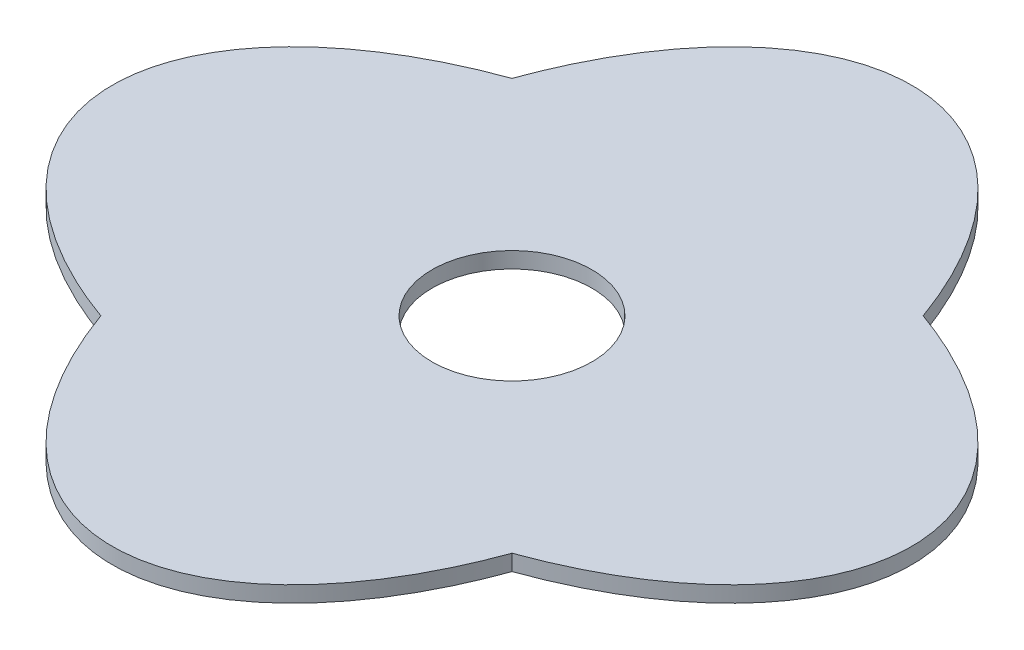
from build123d import *

# Parameters (mm, degrees)
SZKIC1_RX                   = 50
SZKIC1_RY                   = 30
DODANIE_WYCI_GNI_CIE1_DEPTH = 2
WYTNIJ_WYCI_GNI_CIE1_REACH  = 72.739
SZKIC1_4_R                  = 10


with BuildPart() as part:
    # Szkic1 → Dodanie-wyciągnięcie1 (new body)
    with BuildSketch(Plane(origin=(0, 0, 0), x_dir=(1, 0, 0), z_dir=(0, 1, 0))):
        with Locations(Location((0, 0), (0, 0, -90))):
            Ellipse(SZKIC1_RX, SZKIC1_RY)
        with Locations((0, 0)):
            Ellipse(SZKIC1_RX, SZKIC1_RY)
    extrude(amount=DODANIE_WYCI_GNI_CIE1_DEPTH)

    # Szkic1<4> → Wytnij-wyciągnięcie1 (cut, up to next)
    with BuildSketch(Plane(origin=(0, 0, 0), x_dir=(1, 0, 0), z_dir=(0, 1, 0)), mode=Mode.PRIVATE) as wytnij_wyci_gni_cie1_sk1:
        Circle(SZKIC1_4_R)
    wytnij_wyci_gni_cie1_tool1 = extrude(wytnij_wyci_gni_cie1_sk1.sketch, amount=WYTNIJ_WYCI_GNI_CIE1_REACH, mode=Mode.PRIVATE) & part.part
    add(wytnij_wyci_gni_cie1_tool1.solids().sort_by_distance((0, 0, 0))[0], mode=Mode.SUBTRACT)


solid = part.part
